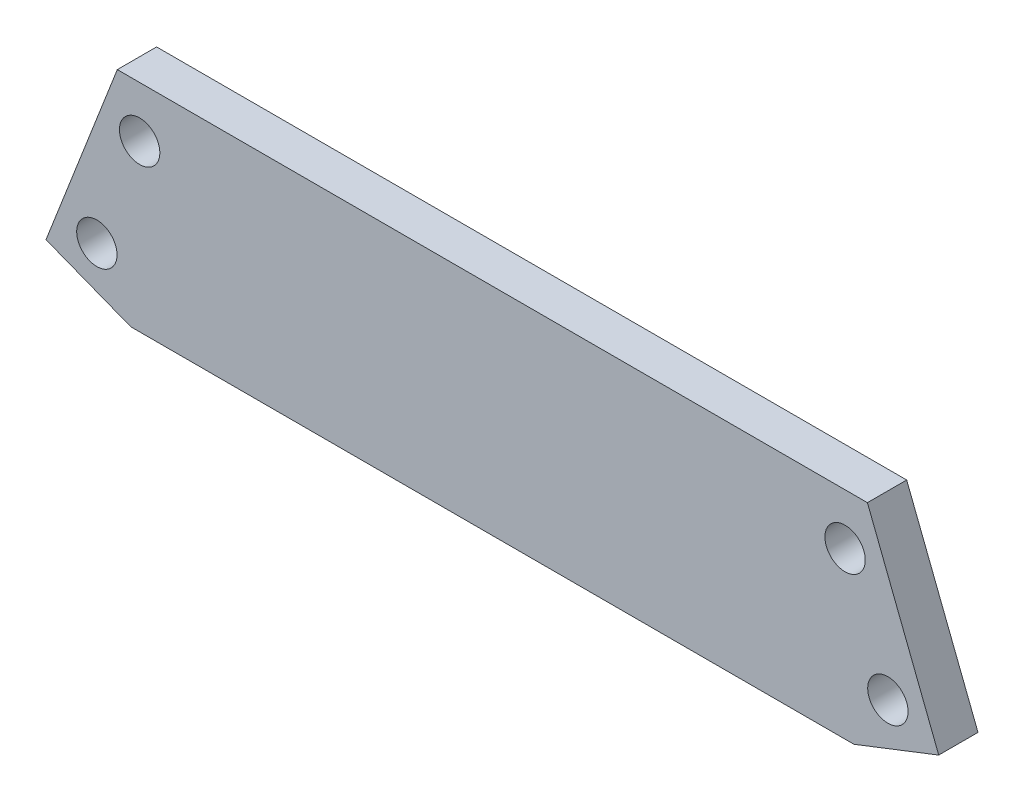
from build123d import *

# Parameters (mm, degrees)
SKETCH1_R           = 3.2639
BOSS_EXTRUDE1_DEPTH = 6.35


with BuildPart() as part:
    # Sketch1 → Boss-Extrude1 (new body)
    with BuildSketch(Plane(origin=(0, 0, -140.49375), x_dir=(-1, 0, 0), z_dir=(0, 0, -1))):
        Polygon((-60.643192472, 1084.088651888), (60.643192472, 1084.088651888), (72.174242173, 1054.50660678), (58.467291227, 1049.163651888), (-58.467291227, 1049.163651888), (-72.174242173, 1054.50660678), align=None)
        with Locations((-57.03299339, 1075.866032926)):
            Circle(SKETCH1_R, mode=Mode.SUBTRACT)
        with Locations((-63.951623211, 1058.116805861)):
            Circle(SKETCH1_R, mode=Mode.SUBTRACT)
        with Locations((57.03299339, 1075.866032926)):
            Circle(SKETCH1_R, mode=Mode.SUBTRACT)
        with Locations((63.951623211, 1058.116805861)):
            Circle(SKETCH1_R, mode=Mode.SUBTRACT)
    extrude(amount=BOSS_EXTRUDE1_DEPTH)


solid = part.part
